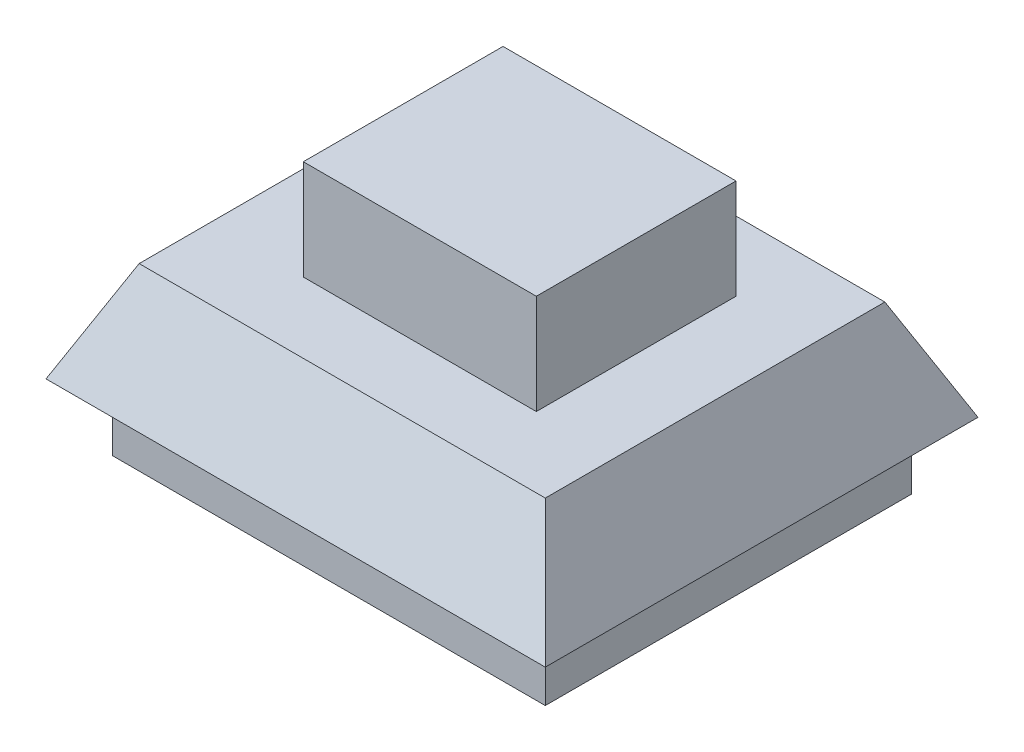
from build123d import *

# Parameters (mm, degrees)
SKETCH1_W           = 15
SKETCH1_H           = 13
BOSS_EXTRUDE1_DEPTH = 3
BOSS_EXTRUDE1_TAPER = 25
SKETCH2_W           = 7
SKETCH2_H           = 6
BOSS_EXTRUDE2_DEPTH = 3
SKETCH4_W           = 13
SKETCH4_H           = 11
BOSS_EXTRUDE3_DEPTH = 2


with BuildPart() as part:
    # Sketch1 → Boss-Extrude1 (new body)
    with BuildSketch(Plane(origin=(0, 0, 0), x_dir=(1, 0, 0), z_dir=(0, 1, 0))):
        with Locations((-1.976635514, -0.911214953)):
            Rectangle(SKETCH1_W, SKETCH1_H)
    extrude(amount=BOSS_EXTRUDE1_DEPTH, taper=BOSS_EXTRUDE1_TAPER)

    # Sketch2 → Boss-Extrude2 (add)
    with BuildSketch(Plane(origin=(0, 3, 0), x_dir=(1, 0, 0), z_dir=(0, 1, 0))):
        with Locations((-1.761302023, -0.89583399)):
            Rectangle(SKETCH2_W, SKETCH2_H)
    extrude(amount=BOSS_EXTRUDE2_DEPTH)

    # Sketch4 → Boss-Extrude3 (add)
    with BuildSketch(Plane.XZ):
        with Locations((-1.976635514, 0.911214953)):
            Rectangle(SKETCH4_W, SKETCH4_H)
    extrude(amount=BOSS_EXTRUDE3_DEPTH)


solid = part.part
